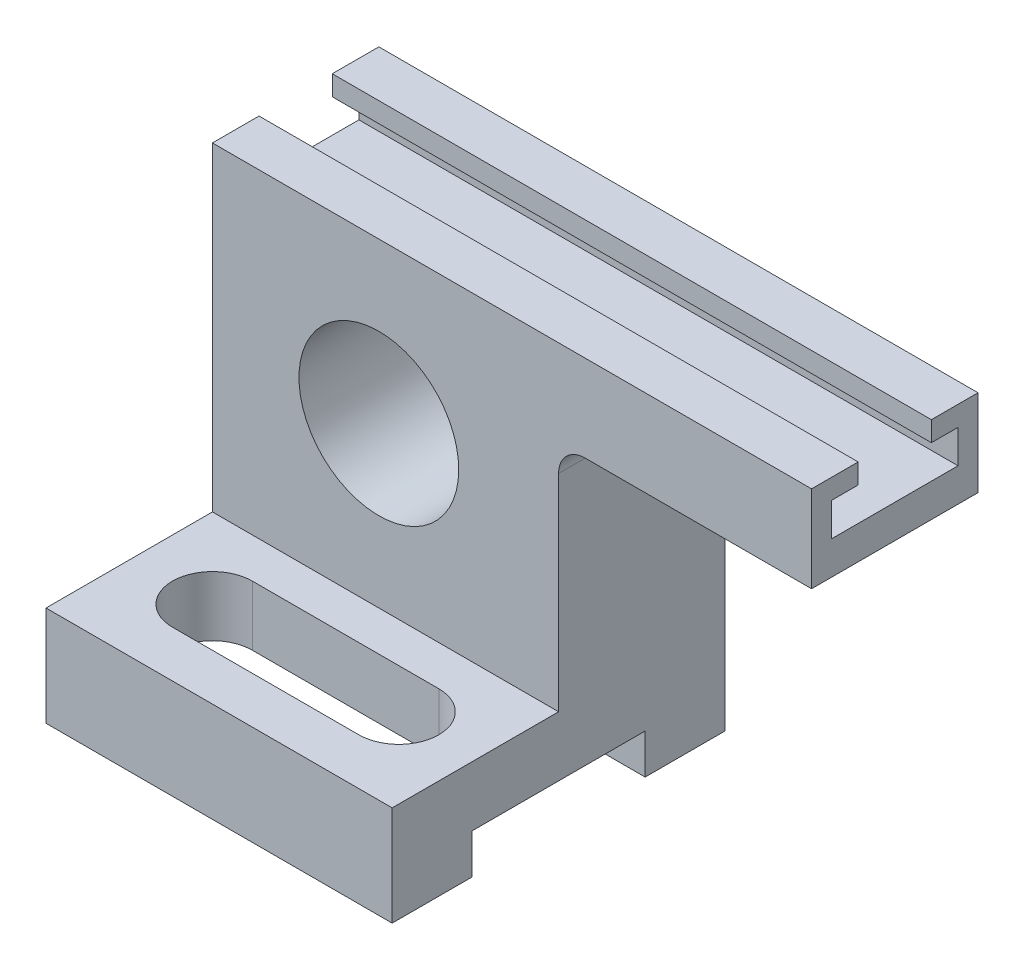
from build123d import *

# Parameters (mm, degrees)
BOSS_EXTRUDE3_DEPTH = 50
SKETCH1_5_W         = 104
SKETCH1_5_H         = 30
BOSS_EXTRUDE4_DEPTH = 100
SKETCH4_W           = 52
SKETCH4_H           = 12
CUT_EXTRUDE1_DEPTH  = 242.404225315
CUT_EXTRUDE2_DEPTH  = 242.404225315
CUT_EXTRUDE3_DEPTH  = 228.191549139
SKETCH7_R           = 24
CUT_EXTRUDE4_DEPTH  = 226.335305711
FILLET3_R           = 8


with BuildPart() as part:
    # Sketch1 → Boss-Extrude3 (new body)
    with BuildSketch(Plane.XY):
        Polygon((0, 126), (0, 30), (104, 30), (104, 100), (180, 100), (180, 126), align=None)
    extrude(amount=BOSS_EXTRUDE3_DEPTH)

    # Sketch1<5> → Boss-Extrude4 (add)
    with BuildSketch(Plane.XY):
        with Locations((52, 15)):
            Rectangle(SKETCH1_5_W, SKETCH1_5_H)
    extrude(amount=BOSS_EXTRUDE4_DEPTH)

    # Sketch4 → Cut-Extrude1 (cut, through all)
    with BuildSketch(Plane(origin=(180, 0, 0), x_dir=(0, 0, -1), z_dir=(1, 0, 0))):
        with Locations((-50, 6)):
            Rectangle(SKETCH4_W, SKETCH4_H)
    extrude(amount=-CUT_EXTRUDE1_DEPTH, mode=Mode.SUBTRACT)

    # Sketch4<5> → Cut-Extrude2 (cut, through all)
    with BuildSketch(Plane(origin=(180, 0, 0), x_dir=(0, 0, -1), z_dir=(1, 0, 0))):
        Polygon((-36, 126), (-36, 120), (-44, 120), (-44, 110), (-6, 110), (-6, 120), (-14, 120), (-14, 126), align=None)
    extrude(amount=-CUT_EXTRUDE2_DEPTH, mode=Mode.SUBTRACT)

    # Sketch5 → Cut-Extrude3 (cut, through all)
    with BuildSketch(Plane(origin=(0, 30, 0), x_dir=(1, 0, 0), z_dir=(0, 1, 0))):
        with BuildLine():
            Line((24, -62), (80, -62))
            ThreePointArc((80, -62), (92, -74), (80, -86))
            Line((80, -86), (24, -86))
            ThreePointArc((24, -86), (12, -74), (24, -62))
        make_face()
    extrude(amount=-CUT_EXTRUDE3_DEPTH, mode=Mode.SUBTRACT)

    # Sketch7 → Cut-Extrude4 (cut, through all)
    with BuildSketch(Plane.XY.offset(50)):
        with Locations((50, 78)):
            Circle(SKETCH7_R)
    extrude(amount=-CUT_EXTRUDE4_DEPTH, mode=Mode.SUBTRACT)

    # Fillet3
    fillet3_edges = [part.edges().sort_by_distance(p)[0] for p in [
        (104, 100, 25),
    ]]
    fillet(fillet3_edges, radius=FILLET3_R)


solid = part.part
